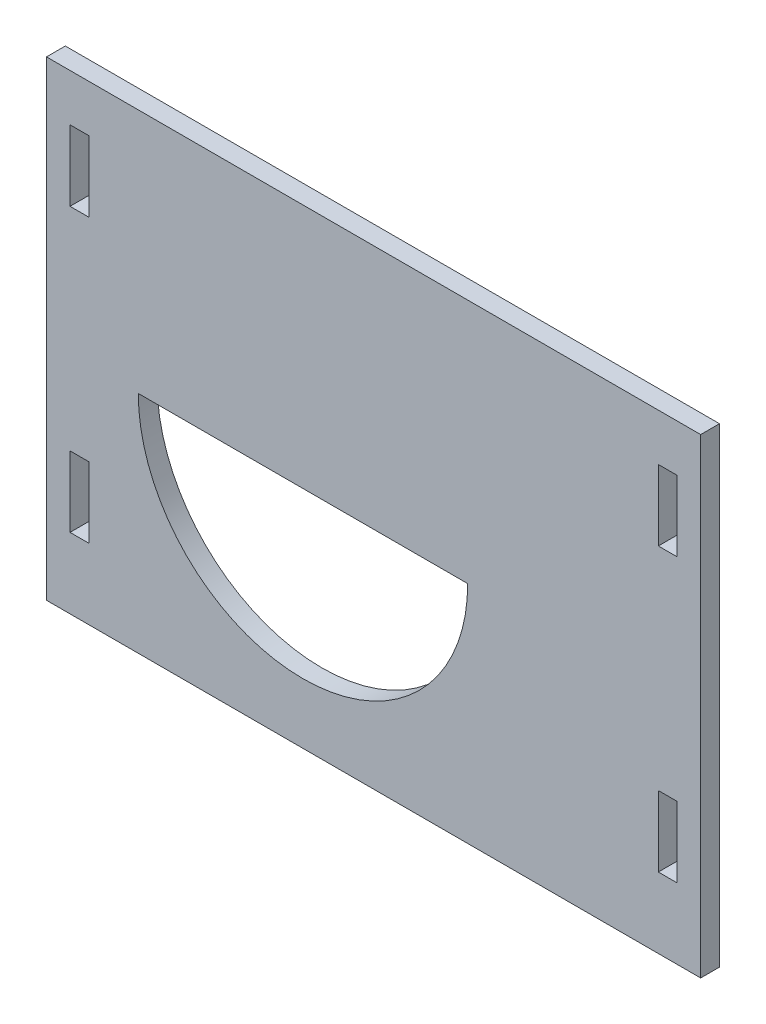
from build123d import *

# Parameters (mm, degrees)
SKETCH1_W           = 4
SKETCH1_H           = 15
BOSS_EXTRUDE1_DEPTH = 4


with BuildPart() as part:
    # Sketch1 → Boss-Extrude1 (new body)
    with BuildSketch(Plane.XY):
        Polygon((-54.5, -52.5), (64.5, -52.5), (84.5, -52.5), (84.5, 47.5), (64.5, 47.5), (-54.5, 47.5), align=None)
        with BuildLine():
            Line((-35, -4.678634488), (35, -4.678634488))
            ThreePointArc((35, -4.678634488), (0, -39.678634488), (-35, -4.678634488))
        make_face(mode=Mode.SUBTRACT)
        with Locations((-47.5, -30)):
            Rectangle(SKETCH1_W, SKETCH1_H, mode=Mode.SUBTRACT)
        with Locations((-47.5, 30)):
            Rectangle(SKETCH1_W, SKETCH1_H, mode=Mode.SUBTRACT)
        with Locations((77.5, 30)):
            Rectangle(SKETCH1_W, SKETCH1_H, mode=Mode.SUBTRACT)
        with Locations((77.5, -30)):
            Rectangle(SKETCH1_W, SKETCH1_H, mode=Mode.SUBTRACT)
    extrude(amount=BOSS_EXTRUDE1_DEPTH)


solid = part.part
